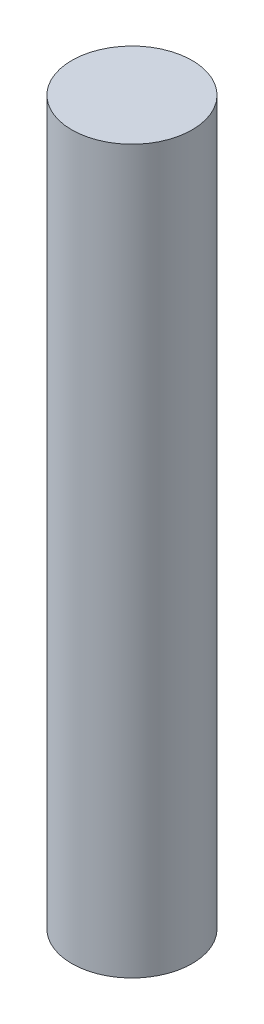
from build123d import *

# Parameters (mm, degrees)
SKETCH1_R           = 2.5
BOSS_EXTRUDE1_DEPTH = 30


with BuildPart() as part:
    # Sketch1 → Boss-Extrude1 (new body)
    with BuildSketch(Plane(origin=(0, 0, 0), x_dir=(1, 0, 0), z_dir=(0, 1, 0))):
        with Locations(Location((0, 0, 0), (0, 0, 270))):
            Circle(SKETCH1_R)
    extrude(amount=BOSS_EXTRUDE1_DEPTH)


solid = part.part
